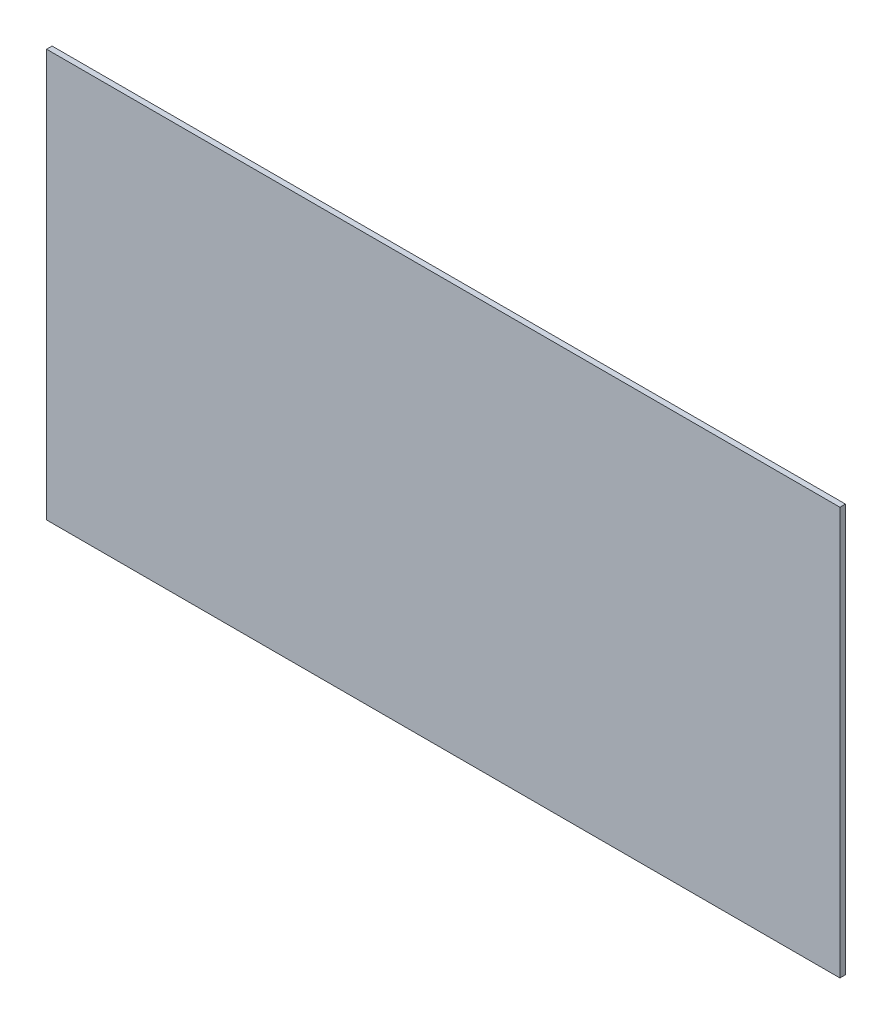
from build123d import *

# Parameters (mm, degrees)
SKETCH1_W           = 1828.8
SKETCH1_H           = 939.8
BOSS_EXTRUDE1_DEPTH = 6.35


with BuildPart() as part:
    # Sketch1 → Boss-Extrude1 (new, symmetric)
    with BuildSketch(Plane.XY):
        Rectangle(SKETCH1_W, SKETCH1_H)
    extrude(amount=BOSS_EXTRUDE1_DEPTH, both=True)


solid = part.part
